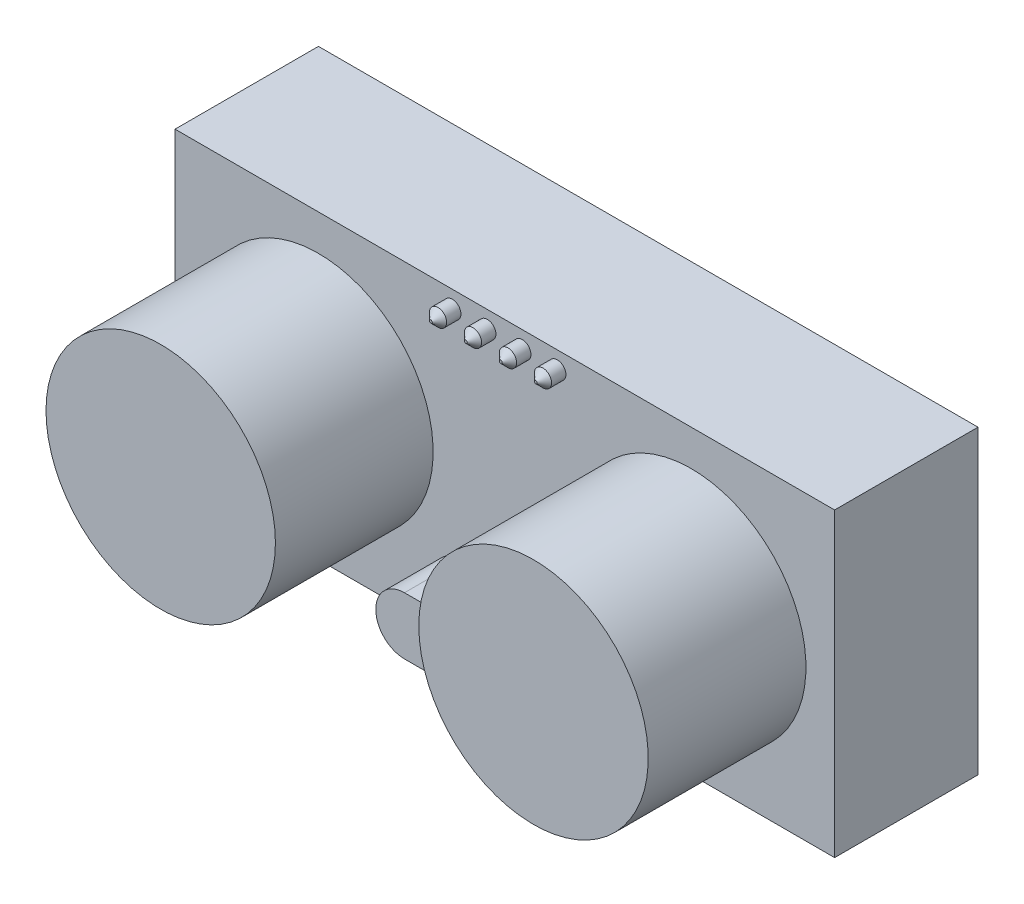
from build123d import *

# Parameters (mm, degrees)
SZKIC1_W                    = 46
SZKIC1_H                    = 21
DODANIE_WYCI_GNI_CIE1_DEPTH = 10
SZKIC2_R                    = 8
DODANIE_WYCI_GNI_CIE2_DEPTH = 11
DODANIE_WYCI_GNI_CIE3_DEPTH = 4
SZKIC4_R                    = 0.6
DODANIE_WYCI_GNI_CIE4_DEPTH = 1.5
SFAZOWANIE1_SIZE            = 0.5


with BuildPart() as part:
    # Szkic1 → Dodanie-wyciągnięcie1 (new body)
    with BuildSketch(Plane.XY):
        Rectangle(SZKIC1_W, SZKIC1_H)
    extrude(amount=DODANIE_WYCI_GNI_CIE1_DEPTH)

    # Szkic2 → Dodanie-wyciągnięcie2 (add)
    with BuildSketch(Plane.XY.offset(10)):
        with Locations(Location((-13, 0, 0), (0, 0, 180))):
            Circle(SZKIC2_R)
        with Locations(Location((13, 0, 0), (0, 0, 180))):
            Circle(SZKIC2_R)
    extrude(amount=DODANIE_WYCI_GNI_CIE2_DEPTH)

    # Szkic3 → Dodanie-wyciągnięcie3 (add)
    with BuildSketch(Plane.XY.offset(10)):
        with BuildLine():
            Line((-3, -5.5), (3, -5.5))
            ThreePointArc((3, -5.5), (5, -7.5), (3, -9.5))
            Line((3, -9.5), (-3, -9.5))
            ThreePointArc((-3, -9.5), (-5, -7.5), (-3, -5.5))
        make_face()
    extrude(amount=DODANIE_WYCI_GNI_CIE3_DEPTH)

    # Szkic4 → Dodanie-wyciągnięcie4 (add)
    with BuildSketch(Plane.XY.offset(10)):
        with Locations(Location((-3.66, 9.3, 0), (0, 0, 180))):
            Circle(SZKIC4_R)
        with Locations(Location((-1.22, 9.3, 0), (0, 0, 180))):
            Circle(SZKIC4_R)
        with Locations(Location((3.66, 9.3, 0), (0, 0, 180))):
            Circle(SZKIC4_R)
        with Locations(Location((1.22, 9.3, 0), (0, 0, 180))):
            Circle(SZKIC4_R)
    extrude(amount=DODANIE_WYCI_GNI_CIE4_DEPTH)

    # Sfazowanie1
    sfazowanie1_edges = [part.edges().sort_by_distance(p)[0] for p in [
        (-3.06, 9.3, 11.5),
        (-0.62, 9.3, 11.5),
        (4.26, 9.3, 11.5),
        (1.82, 9.3, 11.5),
    ]]
    chamfer(sfazowanie1_edges, length=SFAZOWANIE1_SIZE)


solid = part.part
